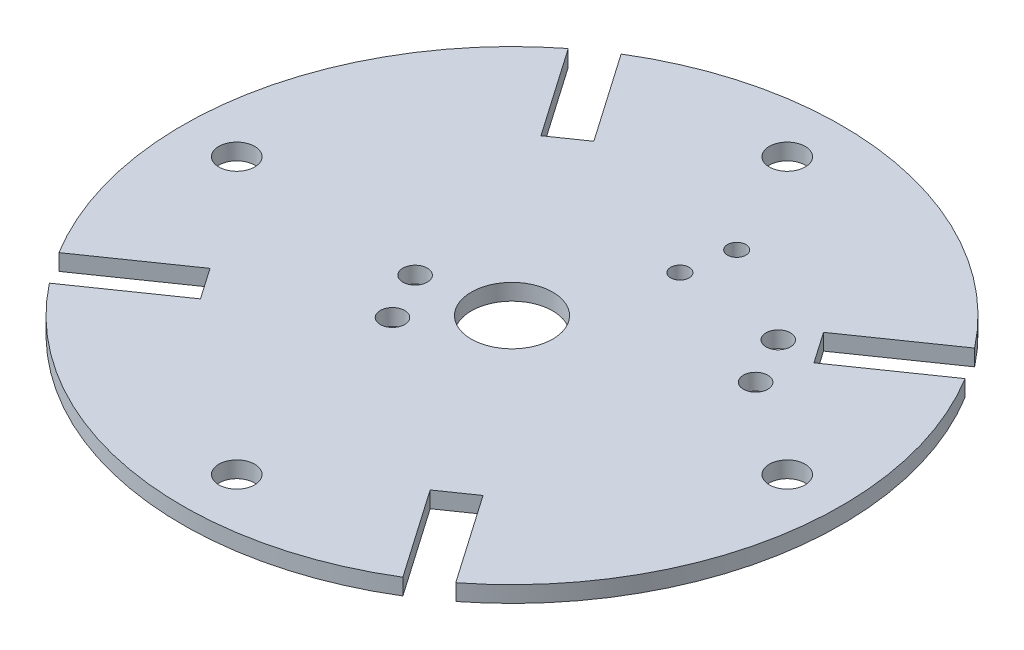
from build123d import *

# Parameters (mm, degrees)
SKETCH1_R                   = 60.7
BOSS_EXTRUDE1_DEPTH         = 1.5
M6_CLEARANCE_HOLE1_D        = 6.6
CIRPATTERN2_COUNT           = 4
SKETCH10_R                  = 7.5
SERVO_HUB_HOLE_DEPTH        = 86.895168665
SKETCH11_R                  = 2.25
SERVO_SCREW_HOLES_DEPTH     = 86.895168665
LEG_MECHANISM_CUTOUTS_DEPTH = 86.895168665
CIRPATTERN3_COUNT           = 4
M3_CLEARANCE_HOLE1_D        = 3.4


with BuildPart() as part:
    # Sketch1 → Boss-Extrude1 (new, symmetric)
    with BuildSketch(Plane(origin=(0, 0, 0), x_dir=(1, 0, 0), z_dir=(0, 1, 0))):
        with Locations(Location((0, 0, 0), (0, 0, 270))):
            Circle(SKETCH1_R)
    extrude(amount=BOSS_EXTRUDE1_DEPTH, both=True)

    # M6 Clearance Hole1 (through all)
    with Locations(Plane(origin=(0, 1.5, 0), x_dir=(1, 0, 0), z_dir=(0, 1, 0))):
        with Locations((50.7, 0)):
            m6_clearance_hole1 = Hole(M6_CLEARANCE_HOLE1_D / 2)

    # CirPattern2: M6 Clearance Hole1 ×4 about axis
    cirpattern2_axis = Axis((0, 0, 0), (0, 1, 0))
    for i in range(1, CIRPATTERN2_COUNT):
        add(m6_clearance_hole1.rotate(cirpattern2_axis, i * 360 / CIRPATTERN2_COUNT), mode=Mode.SUBTRACT)

    # Sketch10 → servo hub hole (cut, through all)
    with BuildSketch(Plane(origin=(0, 1.5, 0), x_dir=(1, 0, 0), z_dir=(0, 1, 0))):
        with Locations(Location((0, 0, 0), (0, 0, 270))):
            Circle(SKETCH10_R)
    extrude(amount=-SERVO_HUB_HOLE_DEPTH, mode=Mode.SUBTRACT)

    # Sketch11 → servo screw holes (cut, through all)
    with BuildSketch(Plane.XZ.offset(1.5)):
        with Locations(Location((-15.377499853, 2.468805027, 0), (0, 0, 270))):
            Circle(SKETCH11_R)
        with Locations(Location((-10.706440914, 11.310818846, 0), (0, 0, 270))):
            Circle(SKETCH11_R)
        with Locations(Location((28.390468552, -20.652936726, 0), (0, 0, 270))):
            Circle(SKETCH11_R)
        with Locations(Location((33.061527492, -11.810922906, 0), (0, 0, 270))):
            Circle(SKETCH11_R)
    extrude(amount=-SERVO_SCREW_HOLES_DEPTH, mode=Mode.SUBTRACT)

    # Sketch13 → leg mechanism cutouts (cut, through all)
    with BuildSketch(Plane(origin=(0, 1.5, 0), x_dir=(1, 0, 0), z_dir=(0, 1, 0))):
        with BuildLine():
            Line((31.677366544, -51.77870652), (20.273657909, -35.348386091))
            Line((20.273657909, -35.348386091), (26.024270059, -31.357088069))
            Line((26.024270059, -31.357088069), (37.427978694, -47.787408498))
            ThreePointArc((37.427978694, -47.787408498), (34.610255706, -49.8660225), (31.677366544, -51.77870652))
        make_face()
    leg_mechanism_cutouts = extrude(amount=-LEG_MECHANISM_CUTOUTS_DEPTH, mode=Mode.SUBTRACT)

    # CirPattern3: leg mechanism cutouts ×4 about axis
    cirpattern3_axis = Axis((0, 0, 0), (0, 1, 0))
    for i in range(1, CIRPATTERN3_COUNT):
        add(leg_mechanism_cutouts.rotate(cirpattern3_axis, i * 360 / CIRPATTERN3_COUNT), mode=Mode.SUBTRACT)

    # M3 Clearance Hole1 (through all)
    with Locations(Plane(origin=(0, 1.5, 0), x_dir=(1, 0, 0), z_dir=(0, 1, 0))):
        with Locations((8.604729668, 22.326187031), (10.204187746, 31.182920845)):
            Hole(M3_CLEARANCE_HOLE1_D / 2)


solid = part.part
